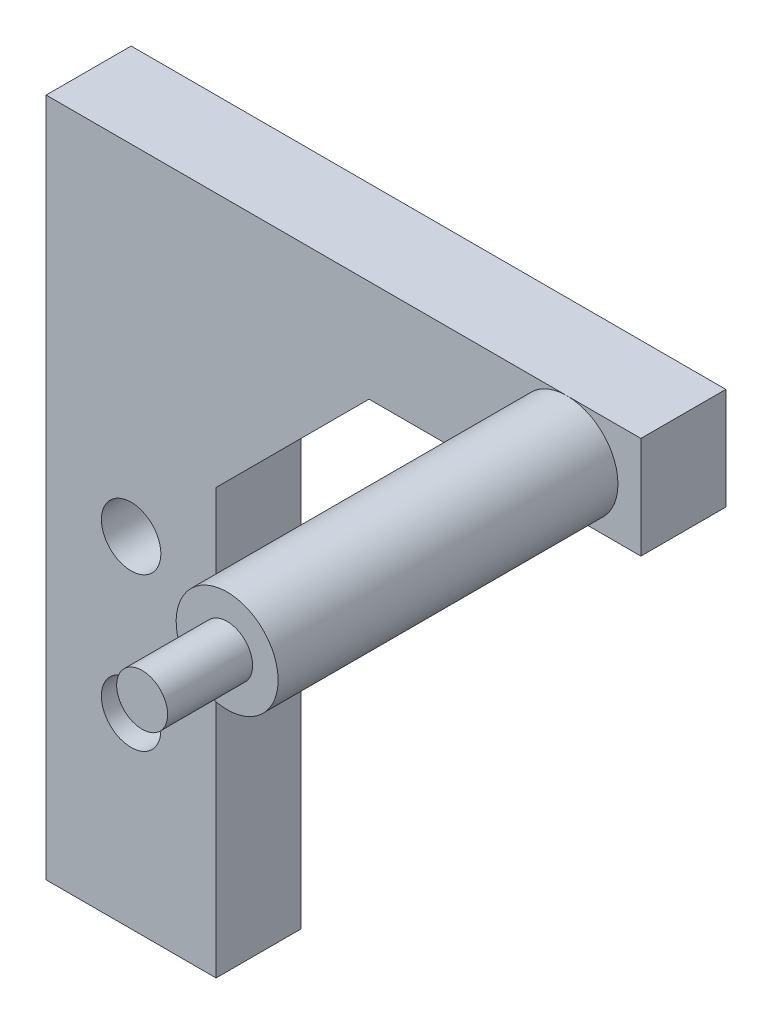
from build123d import *

# Parameters (mm, degrees)
SKIZZE2_W                       = 10
SKIZZE2_H                       = 40
AUFSATZ_LINEAR_AUSTRAGEN1_DEPTH = 5
SKIZZE4_R                       = 1.75
SCHNITT_LINEAR_AUSTRAGEN1_DEPTH = 5
SKIZZE5_W                       = 5
SKIZZE5_H                       = 5
SCHNITT_LINEAR_AUSTRAGEN2_DEPTH = 2
SKIZZE6_W                       = 25
SKIZZE6_H                       = 6
AUFSATZ_LINEAR_AUSTRAGEN3_DEPTH = 5
SKIZZE7_R                       = 3
AUFSATZ_LINEAR_AUSTRAGEN4_DEPTH = 20
SKIZZE8_R                       = 1.5
AUFSATZ_LINEAR_AUSTRAGEN5_DEPTH = 5
AUFSATZ_LINEAR_AUSTRAGEN6_DEPTH = 5


with BuildPart() as part:
    # Skizze2 → Aufsatz-Linear austragen1 (new body)
    with BuildSketch(Plane.XY):
        Rectangle(SKIZZE2_W, SKIZZE2_H)
    extrude(amount=AUFSATZ_LINEAR_AUSTRAGEN1_DEPTH)

    # Skizze4 → Schnitt-Linear austragen1 (cut)
    with BuildSketch(Plane.XY.offset(5)):
        Circle(SKIZZE4_R)
        with Locations((0, -9)):
            Circle(SKIZZE4_R)
    extrude(amount=-SCHNITT_LINEAR_AUSTRAGEN1_DEPTH, mode=Mode.SUBTRACT)

    # Skizze5 → Schnitt-Linear austragen2 (cut)
    with BuildSketch(Plane(origin=(0, 0, 0), x_dir=(-1, 0, 0), z_dir=(0, 0, -1))):
        with Locations((0, 15)):
            Rectangle(SKIZZE5_W, SKIZZE5_H)
    extrude(amount=-SCHNITT_LINEAR_AUSTRAGEN2_DEPTH, mode=Mode.SUBTRACT)

    # Skizze6 → Aufsatz-Linear austragen3 (add)
    with BuildSketch(Plane.XY.offset(5)):
        with Locations((17.5, 17)):
            Rectangle(SKIZZE6_W, SKIZZE6_H)
    extrude(amount=-AUFSATZ_LINEAR_AUSTRAGEN3_DEPTH)

    # Skizze7 → Aufsatz-Linear austragen4 (add)
    with BuildSketch(Plane.XY.offset(5)):
        with Locations(Location((25.65, 17, 0), (0, 0, 270))):
            Circle(SKIZZE7_R)
    extrude(amount=AUFSATZ_LINEAR_AUSTRAGEN4_DEPTH)

    # Skizze8 → Aufsatz-Linear austragen5 (add)
    with BuildSketch(Plane.XY.offset(25)):
        with Locations((25.65, 17)):
            Circle(SKIZZE8_R)
    extrude(amount=AUFSATZ_LINEAR_AUSTRAGEN5_DEPTH)

    # Skizze9 → Aufsatz-Linear austragen6 (add)
    with BuildSketch(Plane.XY.offset(5)):
        Polygon((5, 14), (5, 10.656854249), (8.343145751, 14), align=None)
        Polygon((5, 10.656854249), (5, 5), (14, 14), (8.343145751, 14), align=None)
    extrude(amount=-AUFSATZ_LINEAR_AUSTRAGEN6_DEPTH)


solid = part.part
